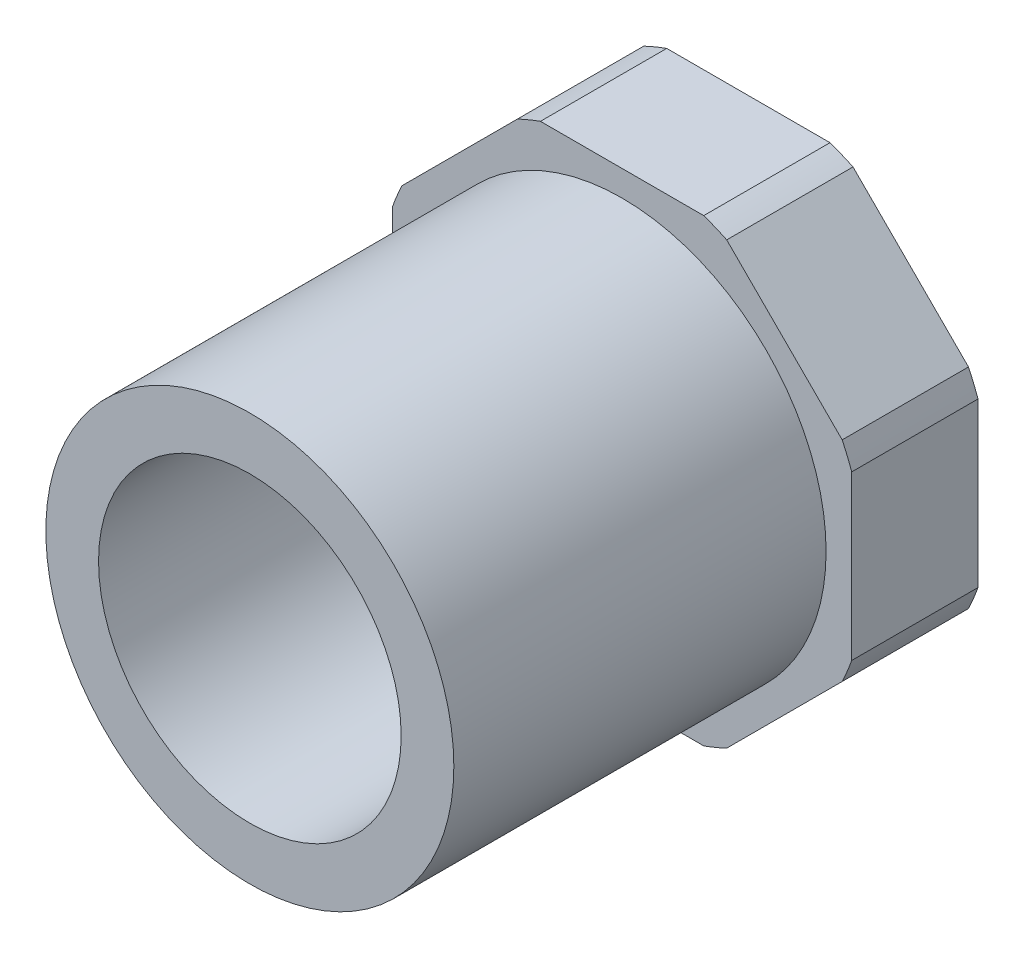
from build123d import *

# Parameters (mm, degrees)
BOSS_EXTRUDE1_START = -6.63575
SKETCH4_R           = 10.7188
BOSS_EXTRUDE1_DEPTH = 6.63575
SKETCH5_W           = 6.63575
SKETCH5_H           = 0.254
CUT_EXTRUDE1_START  = 26.19375
SKETCH6_R           = 1.984375
CUT_EXTRUDE1_DEPTH  = 50.8


with BuildPart() as part:
    # Sketch3 → Revolve1 (revolve)
    with BuildSketch(Plane(origin=(0, 0, 0), x_dir=(0, 0, -1), z_dir=(1, 0, 0)), mode=Mode.PRIVATE) as revolve1_sk:
        with BuildLine():
            Line((6.461125, 0), (13.096875, 0))
            Line((13.096875, 0), (13.096875, -10.7188))
            Line((13.096875, -10.7188), (-13.096875, -10.7188))
            Line((-13.096875, -10.7188), (-13.096875, -7.9502))
            Line((-13.096875, -7.9502), (4.873625, -7.9502))
            ThreePointArc((4.873625, -7.9502), (6.060370876, -4.053573618), (6.461125, 0))
        make_face()
    revolve(revolve1_sk.sketch.rotate(Axis((0, 0, 13.096875), (0, 0, -1)), 270), axis=Axis((0, 0, 13.096875), (0, 0, -1)))

    # Sketch4 → Boss-Extrude1 (add)
    with BuildSketch(Plane(origin=(0, 0, -13.096875), x_dir=(-1, 0, 0), z_dir=(0, 0, -1)).offset(BOSS_EXTRUDE1_START)):
        Polygon((4.99748663, 12.065), (-4.99748663, 12.065), (-12.065, 4.99748663), (-12.065, -4.99748663), (-4.99748663, -12.065), (4.99748663, -12.065), (12.065, -4.99748663), (12.065, 4.99748663), align=None)
        with Locations(Location((0, 0, 0), (0, 0, 180))):
            Circle(SKETCH4_R, mode=Mode.SUBTRACT)
    extrude(amount=BOSS_EXTRUDE1_DEPTH)

    # Sketch5 → Cut-Revolve1 (revolve, cut)
    with BuildSketch(Plane(origin=(0, 0, 0), x_dir=(0, 0, -1), z_dir=(0.9238795325112871, -0.3826834323650893, 0)), mode=Mode.PRIVATE) as cut_revolve1_sk:
        with Locations((9.779, 12.932061897)):
            Rectangle(SKETCH5_W, SKETCH5_H)
    revolve(cut_revolve1_sk.sketch.rotate(Axis((0, 0, 13.096875), (0, 0, 1)), 202.5), axis=Axis((0, 0, 13.096875), (0, 0, 1)), mode=Mode.SUBTRACT)

    # Sketch6 → Cut-Extrude1 (cut)
    with BuildSketch(Plane(origin=(-8.103148128, -57.606298873, -13.096875), x_dir=(1, 0, 0), z_dir=(0, 0, 1)).offset(CUT_EXTRUDE1_START)):
        with Locations(Location((8.103148128, 57.606298873, 0), (0, 0, 270))):
            Circle(SKETCH6_R)
    extrude(amount=-CUT_EXTRUDE1_DEPTH, mode=Mode.SUBTRACT)


solid = part.part
